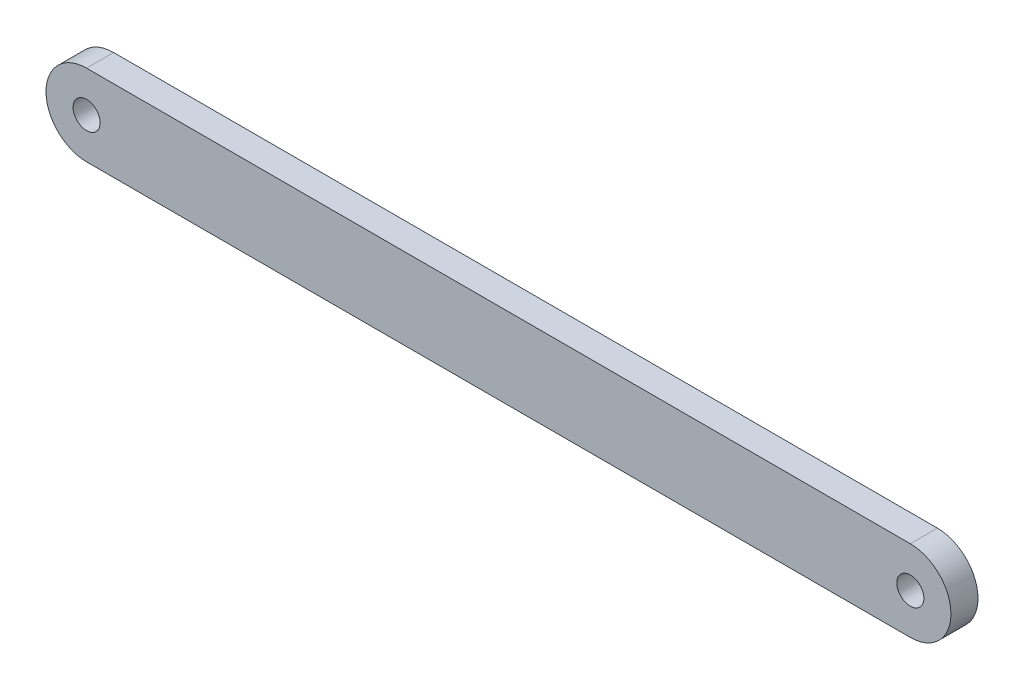
from build123d import *

# Parameters (mm, degrees)
SKETCH1_R           = 2.5
BOSS_EXTRUDE1_DEPTH = 5


with BuildPart() as part:
    # Sketch1 → Boss-Extrude1 (new body)
    with BuildSketch(Plane.XY):
        with BuildLine():
            Line((0, 7.5), (152.204, 7.5))
            ThreePointArc((152.204, 7.5), (159.704, 0), (152.204, -7.5))
            Line((152.204, -7.5), (0, -7.5))
            ThreePointArc((0, -7.5), (-7.5, 0), (0, 7.5))
        make_face()
        Circle(SKETCH1_R, mode=Mode.SUBTRACT)
        with Locations((152.204, 0)):
            Circle(SKETCH1_R, mode=Mode.SUBTRACT)
    extrude(amount=BOSS_EXTRUDE1_DEPTH)


solid = part.part
